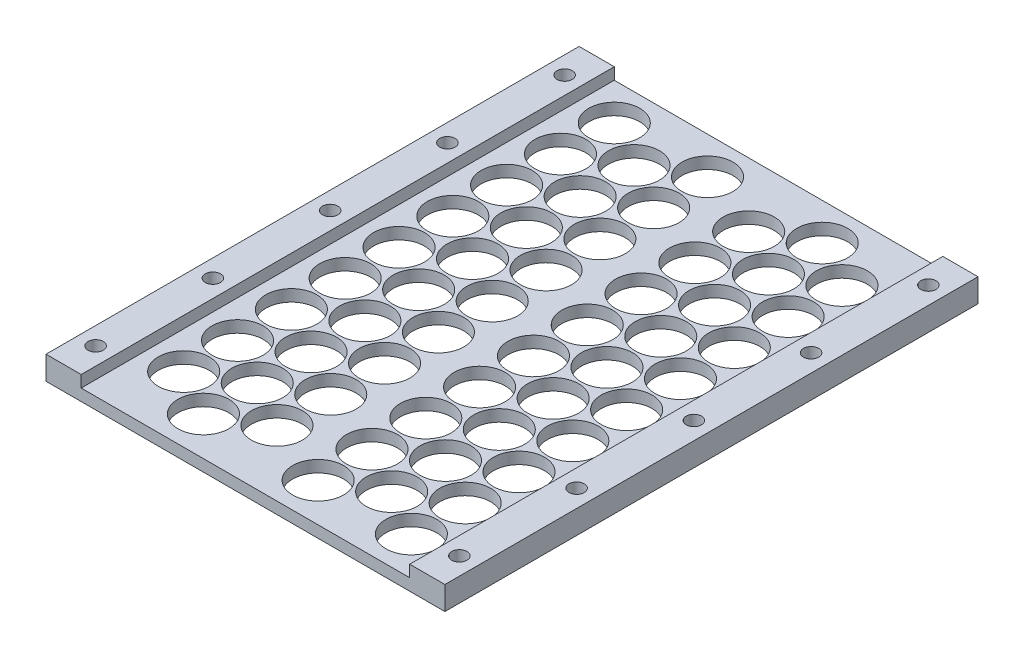
from build123d import *

# Parameters (mm, degrees)
CELL_BLOCK_SKETCH_W  = 140.101132068
CELL_BLOCK_SKETCH_H  = 227.325
BOSS_EXTRUDE1_DEPTH  = 5
CELL_HOLES_PATTERN_R = 10.875
CUT_EXTRUDE1_DEPTH   = 5
SKETCH1_R            = 10.875
CUT_EXTRUDE2_DEPTH   = 5
SKETCH3_W            = 15
SKETCH3_H            = 227.325
BOSS_EXTRUDE3_DEPTH  = 10
SKETCH4_R            = 3.25
CUT_EXTRUDE3_DEPTH   = 10


with BuildPart() as part:
    # Cell Block Sketch → Boss-Extrude1 (new body)
    with BuildSketch(Plane(origin=(0, 0, 0), x_dir=(1, 0, 0), z_dir=(0, 1, 0))):
        Rectangle(CELL_BLOCK_SKETCH_W, CELL_BLOCK_SKETCH_H)
    extrude(amount=BOSS_EXTRUDE1_DEPTH)

    # Cell Holes Pattern → Cut-Extrude1 (cut)
    with BuildSketch(Plane(origin=(0, 0, 0), x_dir=(1, 0, 0), z_dir=(0, 1, 0))):
        with Locations(Location((-34.400283017, 86.4125, 0), (0, 0, 270))):
            Circle(CELL_HOLES_PATTERN_R)
        with Locations(Location((-54.275566034, 97.8875, 0), (0, 0, 270))):
            Circle(CELL_HOLES_PATTERN_R)
        with Locations(Location((-14.525, 97.8875, 0), (0, 0, 270))):
            Circle(CELL_HOLES_PATTERN_R)
        with Locations(Location((-54.275566034, 74.9375, 0), (0, 0, 270))):
            Circle(CELL_HOLES_PATTERN_R)
        with Locations(Location((-34.400283017, 63.4625, 0), (0, 0, 270))):
            Circle(CELL_HOLES_PATTERN_R)
        with Locations(Location((-14.525, 74.9375, 0), (0, 0, 270))):
            Circle(CELL_HOLES_PATTERN_R)
        with Locations(Location((-54.275566034, 51.9875, 0), (0, 0, 270))):
            Circle(CELL_HOLES_PATTERN_R)
        with Locations(Location((-34.400283017, 40.5125, 0), (0, 0, 270))):
            Circle(CELL_HOLES_PATTERN_R)
        with Locations(Location((-14.525, 51.9875, 0), (0, 0, 270))):
            Circle(CELL_HOLES_PATTERN_R)
        with Locations(Location((-54.275566034, 29.0375, 0), (0, 0, 270))):
            Circle(CELL_HOLES_PATTERN_R)
        with Locations(Location((-34.400283017, 17.5625, 0), (0, 0, 270))):
            Circle(CELL_HOLES_PATTERN_R)
        with Locations(Location((-14.525, 29.0375, 0), (0, 0, 270))):
            Circle(CELL_HOLES_PATTERN_R)
        with Locations(Location((-54.275566034, 6.0875, 0), (0, 0, 270))):
            Circle(CELL_HOLES_PATTERN_R)
        with Locations(Location((-34.400283017, -5.3875, 0), (0, 0, 270))):
            Circle(CELL_HOLES_PATTERN_R)
        with Locations(Location((-14.525, 6.0875, 0), (0, 0, 270))):
            Circle(CELL_HOLES_PATTERN_R)
        with Locations(Location((-54.275566034, -16.8625, 0), (0, 0, 270))):
            Circle(CELL_HOLES_PATTERN_R)
        with Locations(Location((-34.400283017, -28.3375, 0), (0, 0, 270))):
            Circle(CELL_HOLES_PATTERN_R)
        with Locations(Location((-14.525, -16.8625, 0), (0, 0, 270))):
            Circle(CELL_HOLES_PATTERN_R)
        with Locations(Location((-54.275566034, -39.8125, 0), (0, 0, 270))):
            Circle(CELL_HOLES_PATTERN_R)
        with Locations(Location((-34.400283017, -51.2875, 0), (0, 0, 270))):
            Circle(CELL_HOLES_PATTERN_R)
        with Locations(Location((-14.525, -39.8125, 0), (0, 0, 270))):
            Circle(CELL_HOLES_PATTERN_R)
        with Locations(Location((-54.275566034, -62.7625, 0), (0, 0, 270))):
            Circle(CELL_HOLES_PATTERN_R)
        with Locations(Location((-34.400283017, -74.2375, 0), (0, 0, 270))):
            Circle(CELL_HOLES_PATTERN_R)
        with Locations(Location((-14.525, -62.7625, 0), (0, 0, 270))):
            Circle(CELL_HOLES_PATTERN_R)
        with Locations(Location((-54.275566034, -85.7125, 0), (0, 0, 270))):
            Circle(CELL_HOLES_PATTERN_R)
        with Locations(Location((-34.400283017, -97.1875, 0), (0, 0, 270))):
            Circle(CELL_HOLES_PATTERN_R)
        with Locations(Location((-14.525, -85.7125, 0), (0, 0, 270))):
            Circle(CELL_HOLES_PATTERN_R)
    extrude(amount=CUT_EXTRUDE1_DEPTH, mode=Mode.SUBTRACT)

    # Sketch1 → Cut-Extrude2 (cut)
    with BuildSketch(Plane(origin=(0, 5, 0), x_dir=(1, 0, 0), z_dir=(0, 1, 0))):
        with Locations(Location((14.525, 86.4125, 0), (0, 0, 270))):
            Circle(SKETCH1_R)
        with Locations(Location((34.400283017, 97.8875, 0), (0, 0, 270))):
            Circle(SKETCH1_R)
        with Locations(Location((54.275566034, 86.4125, 0), (0, 0, 270))):
            Circle(SKETCH1_R)
        with Locations(Location((14.525, 63.4625, 0), (0, 0, 270))):
            Circle(SKETCH1_R)
        with Locations(Location((34.400283017, 74.9375, 0), (0, 0, 270))):
            Circle(SKETCH1_R)
        with Locations(Location((54.275566034, 63.4625, 0), (0, 0, 270))):
            Circle(SKETCH1_R)
        with Locations(Location((14.525, 40.5125, 0), (0, 0, 270))):
            Circle(SKETCH1_R)
        with Locations(Location((34.400283017, 51.9875, 0), (0, 0, 270))):
            Circle(SKETCH1_R)
        with Locations(Location((54.275566034, 40.5125, 0), (0, 0, 270))):
            Circle(SKETCH1_R)
        with Locations(Location((14.525, 17.5625, 0), (0, 0, 270))):
            Circle(SKETCH1_R)
        with Locations(Location((34.400283017, 29.0375, 0), (0, 0, 270))):
            Circle(SKETCH1_R)
        with Locations(Location((54.275566034, 17.5625, 0), (0, 0, 270))):
            Circle(SKETCH1_R)
        with Locations(Location((14.525, -5.3875, 0), (0, 0, 270))):
            Circle(SKETCH1_R)
        with Locations(Location((34.400283017, 6.0875, 0), (0, 0, 270))):
            Circle(SKETCH1_R)
        with Locations(Location((54.275566034, -5.3875, 0), (0, 0, 270))):
            Circle(SKETCH1_R)
        with Locations(Location((14.525, -28.3375, 0), (0, 0, 270))):
            Circle(SKETCH1_R)
        with Locations(Location((34.400283017, -16.8625, 0), (0, 0, 270))):
            Circle(SKETCH1_R)
        with Locations(Location((54.275566034, -28.3375, 0), (0, 0, 270))):
            Circle(SKETCH1_R)
        with Locations(Location((14.525, -51.2875, 0), (0, 0, 270))):
            Circle(SKETCH1_R)
        with Locations(Location((34.400283017, -39.8125, 0), (0, 0, 270))):
            Circle(SKETCH1_R)
        with Locations(Location((54.275566034, -51.2875, 0), (0, 0, 270))):
            Circle(SKETCH1_R)
        with Locations(Location((14.525, -74.2375, 0), (0, 0, 270))):
            Circle(SKETCH1_R)
        with Locations(Location((34.400283017, -62.7625, 0), (0, 0, 270))):
            Circle(SKETCH1_R)
        with Locations(Location((54.275566034, -74.2375, 0), (0, 0, 270))):
            Circle(SKETCH1_R)
        with Locations(Location((14.525, -97.1875, 0), (0, 0, 270))):
            Circle(SKETCH1_R)
        with Locations(Location((34.400283017, -85.7125, 0), (0, 0, 270))):
            Circle(SKETCH1_R)
        with Locations(Location((54.275566034, -97.1875, 0), (0, 0, 270))):
            Circle(SKETCH1_R)
    extrude(amount=-CUT_EXTRUDE2_DEPTH, mode=Mode.SUBTRACT)

    # Sketch3 → Boss-Extrude3 (add)
    with BuildSketch(Plane(origin=(0, 0, 0), x_dir=(1, 0, 0), z_dir=(0, 1, 0))):
        with Locations((-77.550566034, 0)):
            Rectangle(SKETCH3_W, SKETCH3_H)
    boss_extrude3 = extrude(amount=BOSS_EXTRUDE3_DEPTH)

    # Mirror1: Boss-Extrude3 across plane
    add(boss_extrude3.mirror(Plane(origin=(0, 0, 0), x_dir=(0, 0, 1), z_dir=(1, 0, 0))))

    # Sketch4 → Cut-Extrude3 (cut)
    with BuildSketch(Plane(origin=(0, 10, 0), x_dir=(1, 0, 0), z_dir=(0, 1, 0))):
        with Locations(Location((-77.550566034, 0, 0), (0, 0, 270))):
            Circle(SKETCH4_R)
        with Locations(Location((-77.550566034, -50, 0), (0, 0, 270))):
            Circle(SKETCH4_R)
        with Locations(Location((-77.550566034, -100, 0), (0, 0, 270))):
            Circle(SKETCH4_R)
        with Locations(Location((-77.550566034, 50, 0), (0, 0, 270))):
            Circle(SKETCH4_R)
        with Locations(Location((-77.550566034, 100, 0), (0, 0, 270))):
            Circle(SKETCH4_R)
    cut_extrude3 = extrude(amount=-CUT_EXTRUDE3_DEPTH, mode=Mode.SUBTRACT)

    # Mirror2: Cut-Extrude3 across plane
    add(cut_extrude3.mirror(Plane(origin=(0, 0, 0), x_dir=(0, 0, 1), z_dir=(1, 0, 0))), mode=Mode.SUBTRACT)


solid = part.part
